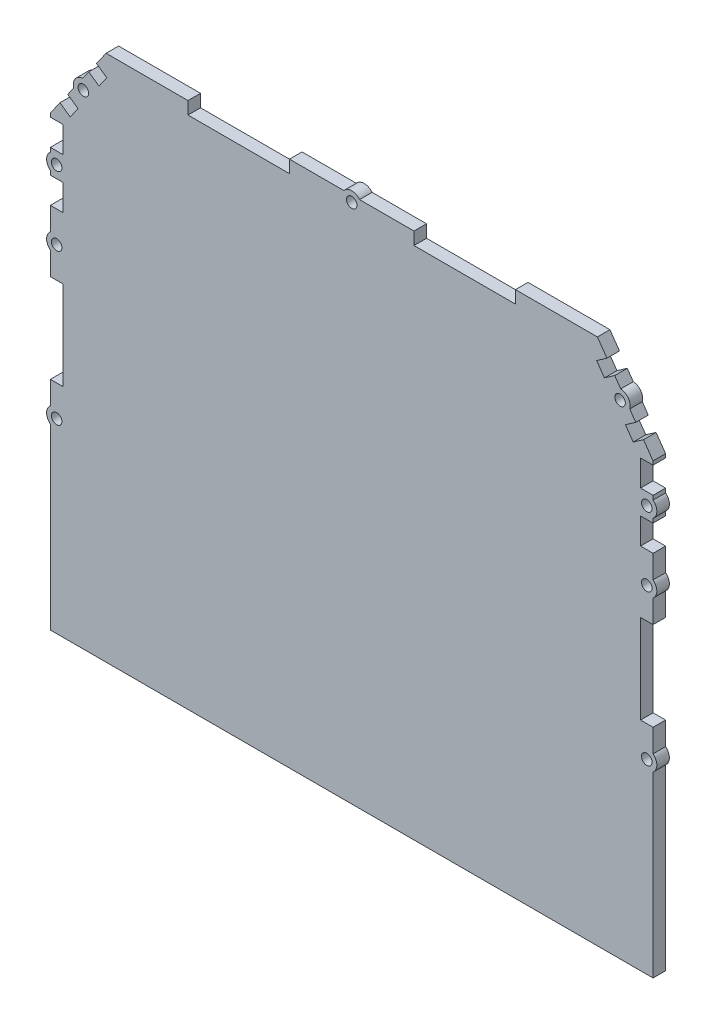
from build123d import *

# Parameters (mm, degrees)
BOSS_EXTRUDE1_DEPTH = 5
CUT_EXTRUDE1_DEPTH  = 5
CUT_EXTRUDE4_DEPTH  = 5
BOSS_EXTRUDE3_DEPTH = 5
SKETCH8_R           = 2.1
SKETCH8_W           = 5
SKETCH8_H           = 10
SKETCH8_W_2         = 40
SKETCH8_H_2         = 5
CUT_EXTRUDE5_DEPTH  = 10
BOSS_EXTRUDE4_DEPTH = 5
SKETCH10_W          = 77.5
SKETCH10_H          = 80
BOSS_EXTRUDE5_DEPTH = 5
CUT_EXTRUDE6_DEPTH  = 5
SKETCH12_R          = 2.1
SKETCH12_W          = 5
SKETCH12_H          = 35
CUT_EXTRUDE7_DEPTH  = 5
BOSS_EXTRUDE6_DEPTH = 5
SKETCH14_W          = 5
SKETCH14_H          = 10.4
SKETCH14_H_2        = 35.4
SKETCH14_W_2        = 40.4
SKETCH14_H_3        = 5
CUT_EXTRUDE8_DEPTH  = 10


with BuildPart() as part:
    # Sketch1 → Boss-Extrude1 (new body)
    with BuildSketch(Plane.XY):
        Polygon((-120, 40), (-42.5, 40), (-42.5, -40), (-120, -40), (-120, -105), (120, -105), (120, -40), (42.5, -40), (42.5, 40), (120, 40), (120, 105), (-120, 105), align=None)
    extrude(amount=BOSS_EXTRUDE1_DEPTH)

    # Sketch2 → Cut-Extrude1 (cut)
    with BuildSketch(Plane.XY.offset(5)):
        Polygon((40, -55.717967697), (-40, -55.717967697), (-80, -125), (-40, -194.282032303), (40, -194.282032303), (80, -125), align=None)
    extrude(amount=-CUT_EXTRUDE1_DEPTH, mode=Mode.SUBTRACT)

    # Sketch5 → Cut-Extrude4 (cut)
    with BuildSketch(Plane.XY.offset(5)):
        Polygon((-97.823933369, 105), (-120, 73.319904814), (-120, 105), align=None)
        Polygon((97.823933369, 105), (120, 105), (120, 73.319904814), align=None)
    extrude(amount=-CUT_EXTRUDE4_DEPTH, mode=Mode.SUBTRACT)

    # Sketch7 → Boss-Extrude3 (add)
    with BuildSketch(Plane(origin=(0, 0, 0), x_dir=(-1, 0, 0), z_dir=(0, 0, -1))):
        Polygon((120, -40), (120, -105), (89.53, -105), (111.53, -122.5), (129.53, -122.5), (129.53, -40), align=None)
    boss_extrude3 = extrude(amount=-BOSS_EXTRUDE3_DEPTH)

    # Mirror2: Boss-Extrude3 across plane
    add(boss_extrude3.mirror(Plane(origin=(0, 0, 0), x_dir=(0, 0, 1), z_dir=(1, 0, 0))))

    # Sketch8 → Cut-Extrude5 (cut)
    with BuildSketch(Plane.XY.offset(5)):
        with Locations((0, 102.5)):
            Circle(SKETCH8_R)
        with Locations((106.863886883, 87.726296546)):
            Circle(SKETCH8_R)
        with Locations((117.5, 56.659952407)):
            Circle(SKETCH8_R)
        with Locations(Location((-117.5, 56.659952407, 0), (0, 0, 180))):
            Circle(SKETCH8_R)
        with Locations(Location((-106.863886883, 87.726296546, 0), (0, 0, 180))):
            Circle(SKETCH8_R)
        Polygon((-113.212934267, 83.015713003), (-116.080245989, 78.9195534), (-111.984086387, 76.052241679), (-109.116774665, 80.148401281), align=None)
        Polygon((-100.514839499, 92.436880089), (-104.610999102, 95.304191811), (-101.74368738, 99.400351413), (-97.647527778, 96.533039691), align=None)
        with Locations((-117.5, 46.659952407)):
            Rectangle(SKETCH8_W, SKETCH8_H)
        with Locations((-117.5, 66.659952407)):
            Rectangle(SKETCH8_W, SKETCH8_H)
        with Locations((-45, 102.5)):
            Rectangle(SKETCH8_W_2, SKETCH8_H_2)
        with Locations((45, 102.5)):
            Rectangle(SKETCH8_W_2, SKETCH8_H_2)
        with Locations((117.5, 66.659952407)):
            Rectangle(SKETCH8_W, SKETCH8_H)
        with Locations((117.5, 46.659952407)):
            Rectangle(SKETCH8_W, SKETCH8_H)
        Polygon((104.610999102, 95.304191811), (101.74368738, 99.400351413), (97.647527778, 96.533039691), (100.514839499, 92.436880089), align=None)
        Polygon((109.116774665, 80.148401281), (113.212934267, 83.015713003), (116.080245989, 78.9195534), (111.984086387, 76.052241679), align=None)
    extrude(amount=-CUT_EXTRUDE5_DEPTH, mode=Mode.SUBTRACT)

    # Sketch9 → Boss-Extrude4 (add)
    with BuildSketch(Plane.XY.offset(5)):
        with BuildLine():
            Line((-3.122498999, 105), (3.122498999, 105))
            ThreePointArc((3.122498999, 105), (0, 106.5), (-3.122498999, 105))
        make_face()
        with BuildLine():
            Line((107.121331088, 91.718003259), (110.702602281, 86.601901555))
            ThreePointArc((110.702602281, 86.601901555), (110.140814565, 90.020145923), (107.121331088, 91.718003259))
        make_face()
        with BuildLine():
            Line((120, 59.782451406), (120, 53.537453408))
            ThreePointArc((120, 53.537453408), (121.5, 56.659952407), (120, 59.782451406))
        make_face()
        with BuildLine():
            Line((-120, 59.782451406), (-120, 53.537453408))
            ThreePointArc((-120, 53.537453408), (-121.5, 56.659952407), (-120, 59.782451406))
        make_face()
        with BuildLine():
            Line((-107.121331088, 91.718003259), (-110.702602281, 86.601901555))
            ThreePointArc((-110.702602281, 86.601901555), (-110.140814565, 90.020145923), (-107.121331088, 91.718003259))
        make_face()
    extrude(amount=-BOSS_EXTRUDE4_DEPTH)

    # Sketch10 → Boss-Extrude5 (add)
    with BuildSketch(Plane.XY.offset(5)):
        with Locations((-81.25, 0)):
            Rectangle(SKETCH10_W, SKETCH10_H)
        Polygon((-68.452994616, -105), (68.452994616, -105), (40, -55.717967697), (-40, -55.717967697), align=None)
        with Locations((81.25, 0)):
            Rectangle(SKETCH10_W, SKETCH10_H)
    extrude(amount=-BOSS_EXTRUDE5_DEPTH)

    # Sketch11 → Cut-Extrude6 (cut)
    with BuildSketch(Plane.XY.offset(5)):
        Polygon((-120, -40), (-120, -105), (120, -105), (120, -40), (129.53, -40), (129.53, -122.5), (-129.53, -122.5), (-129.53, -40), align=None)
    extrude(amount=-CUT_EXTRUDE6_DEPTH, mode=Mode.SUBTRACT)

    # Sketch12 → Cut-Extrude7 (cut)
    with BuildSketch(Plane.XY.offset(5)):
        with Locations((-117.5, 29.159952407)):
            Circle(SKETCH12_R)
        with Locations((-117.5, -30.840047593)):
            Circle(SKETCH12_R)
        with Locations(Location((117.5, -30.840047593, 0), (0, 0, 180))):
            Circle(SKETCH12_R)
        with Locations(Location((117.5, 29.159952407, 0), (0, 0, 180))):
            Circle(SKETCH12_R)
        with Locations((-117.5, -0.840047593)):
            Rectangle(SKETCH12_W, SKETCH12_H)
        with Locations((117.5, -0.840047593)):
            Rectangle(SKETCH12_W, SKETCH12_H)
    extrude(amount=-CUT_EXTRUDE7_DEPTH, mode=Mode.SUBTRACT)

    # Sketch13 → Boss-Extrude6 (add)
    with BuildSketch(Plane.XY.offset(5)):
        with BuildLine():
            Line((-120, 32.282451406), (-120, 26.037453408))
            ThreePointArc((-120, 26.037453408), (-121.5, 29.159952407), (-120, 32.282451406))
        make_face()
        with BuildLine():
            Line((-120, -27.717548594), (-120, -33.962546592))
            ThreePointArc((-120, -33.962546592), (-121.5, -30.840047593), (-120, -27.717548594))
        make_face()
        with BuildLine():
            Line((120, -27.717548594), (120, -33.962546592))
            ThreePointArc((120, -33.962546592), (121.5, -30.840047593), (120, -27.717548594))
        make_face()
        with BuildLine():
            Line((120, 32.282451406), (120, 26.037453408))
            ThreePointArc((120, 26.037453408), (121.5, 29.159952407), (120, 32.282451406))
        make_face()
    extrude(amount=-BOSS_EXTRUDE6_DEPTH)

    # Sketch14 → Cut-Extrude8 (cut)
    with BuildSketch(Plane.XY.offset(5)):
        Polygon((-104.725691571, 95.140345427), (-100.629531968, 92.273033705), (-97.532835309, 96.696886076), (-101.628994911, 99.564197797), align=None)
        Polygon((-112.098778856, 75.888395294), (-116.194938458, 78.755707016), (-113.098241799, 83.179559387), (-109.002082196, 80.312247665), align=None)
        with Locations((-117.5, 66.659952407)):
            Rectangle(SKETCH14_W, SKETCH14_H)
        with Locations((-117.5, 46.659952407)):
            Rectangle(SKETCH14_W, SKETCH14_H)
        with Locations((-117.5, -0.840047593)):
            Rectangle(SKETCH14_W, SKETCH14_H_2)
        with Locations((-45, 102.5)):
            Rectangle(SKETCH14_W_2, SKETCH14_H_3)
        with Locations((45, 102.5)):
            Rectangle(SKETCH14_W_2, SKETCH14_H_3)
        with Locations((117.5, -0.840047593)):
            Rectangle(SKETCH14_W, SKETCH14_H_2)
        with Locations((117.5, 46.659952407)):
            Rectangle(SKETCH14_W, SKETCH14_H)
        with Locations((117.5, 66.659952407)):
            Rectangle(SKETCH14_W, SKETCH14_H)
        Polygon((113.098241799, 83.179559387), (109.002082196, 80.312247665), (112.098778856, 75.888395294), (116.194938458, 78.755707016), align=None)
        Polygon((97.532835309, 96.696886076), (101.628994911, 99.564197797), (104.725691571, 95.140345427), (100.629531968, 92.273033705), align=None)
    extrude(amount=-CUT_EXTRUDE8_DEPTH, mode=Mode.SUBTRACT)


solid = part.part
